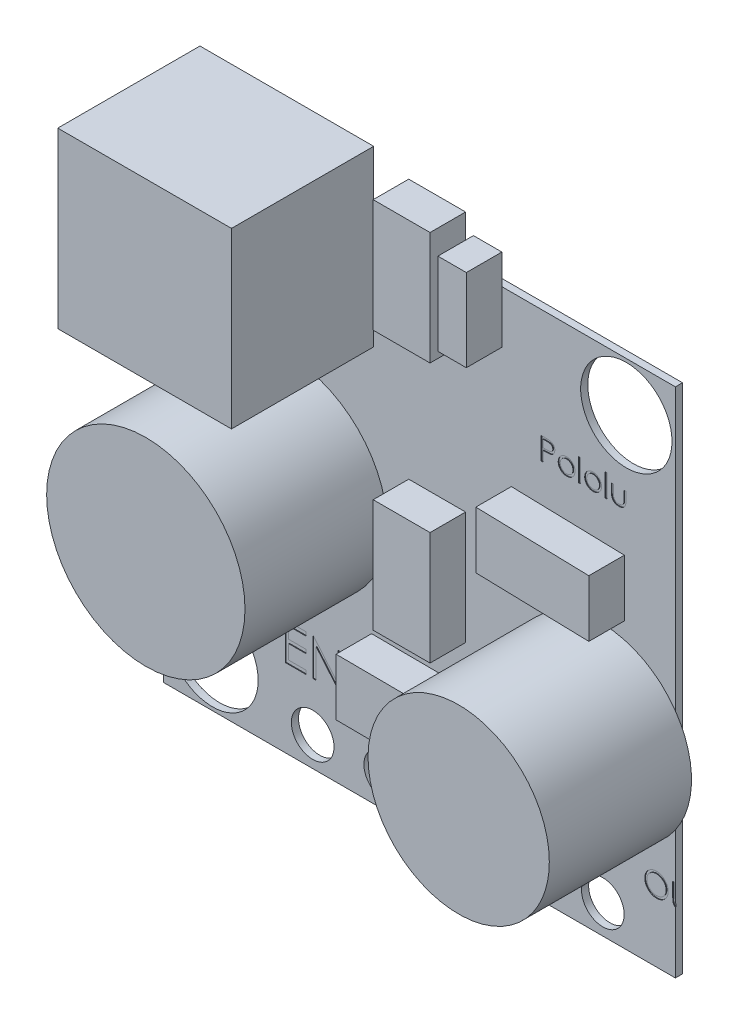
from build123d import *

# Parameters (mm, degrees)
SKETCH1_W           = 18.291840078
SKETCH1_H           = 18.291840078
SKETCH1_R           = 1.63195
SKETCH1_R_2         = 0.762
BOSS_EXTRUDE2_DEPTH = 0.254
SKETCH2_R           = 3.5433
SKETCH2_R_2         = 3.2385
SKETCH2_W           = 6.206288666
SKETCH2_H           = 6.206288667
BOSS_EXTRUDE3_DEPTH = 5.08
SKETCH3_W           = 2.032
SKETCH3_H           = 4.0386
SKETCH3_W_2         = 1.016
SKETCH3_H_2         = 2.9464
BOSS_EXTRUDE4_DEPTH = 1.27
SKETCH4_W           = 0.071233975
SKETCH4_H           = 0.814102564
SKETCH4_W_2         = 0.071233974
SKETCH4_H_2         = 0.79375
CUT_EXTRUDE1_DEPTH  = 0.0254


with BuildPart() as part:
    # Sketch1 → Boss-Extrude2 (new body)
    with BuildSketch(Plane.XY):
        with Locations((8.062281232, 8.564786777)):
            Rectangle(SKETCH1_W, SKETCH1_H)
        with Locations((0.668961193, 1.171466738)):
            Circle(SKETCH1_R, mode=Mode.SUBTRACT)
        with Locations((15.455601271, 15.958106816)):
            Circle(SKETCH1_R, mode=Mode.SUBTRACT)
        with Locations((4.250361193, 0.465539417)):
            Circle(SKETCH1_R_2, mode=Mode.SUBTRACT)
        with Locations((6.841929209, 0.465539417)):
            Circle(SKETCH1_R_2, mode=Mode.SUBTRACT)
        with Locations((9.433497224, 0.465539417)):
            Circle(SKETCH1_R_2, mode=Mode.SUBTRACT)
        with Locations((12.02506524, 0.465539417)):
            Circle(SKETCH1_R_2, mode=Mode.SUBTRACT)
        with Locations((14.616633255, 0.465539417)):
            Circle(SKETCH1_R_2, mode=Mode.SUBTRACT)
    extrude(amount=BOSS_EXTRUDE2_DEPTH)

    # Sketch2 → Boss-Extrude3 (add)
    with BuildSketch(Plane.XY.offset(0.254)):
        with Locations(Location((3.367424674, 8.222212501, 0), (0, 0, 180))):
            Circle(SKETCH2_R)
        with Locations(Location((14.545239743, 5.842060174, 0), (0, 0, 325.313926987))):
            Circle(SKETCH2_R_2)
        with Locations((3.324815917, 16.660413121)):
            Rectangle(SKETCH2_W, SKETCH2_H)
    extrude(amount=BOSS_EXTRUDE3_DEPTH)

    # Sketch3 → Boss-Extrude4 (add)
    with BuildSketch(Plane.XY.offset(0.254)):
        Polygon((6.3543759, 4.646336431), (10.392892165, 4.620330016), (10.393031369, 2.588330021), (6.354515103, 2.614336436), align=None)
        with Locations((8.696702908, 8.069982675)):
            Rectangle(SKETCH3_W, SKETCH3_H)
        with Locations((8.696702908, 17.354271733)):
            Rectangle(SKETCH3_W, SKETCH3_H)
        Polygon((11.34760699, 11.694074063), (15.38486701, 11.590047681), (15.387094643, 9.558048902), (11.349834623, 9.662075284), align=None)
        with Locations((10.50132769, 17.309698928)):
            Rectangle(SKETCH3_W_2, SKETCH3_H_2)
    extrude(amount=BOSS_EXTRUDE4_DEPTH)

    # Sketch4 → Cut-Extrude1 (cut)
    # profile 1 of 17: a face of its own
    with BuildSketch(Plane.XY.offset(0.254)):
        with BuildLine():
            Line((12.411607051, 13.80859367), (12.567272366, 13.80859367))
            add(Edge.make_bspline(
                [(12.567272366, 13.80859367), (12.577979125, 13.8085819), (12.598493751, 13.80855935), (12.627911272, 13.807875649), (12.654628837, 13.806962452), (12.678588834, 13.805696559), (12.699864985, 13.804200546), (12.718361015, 13.802102316), (12.734222307, 13.799911499), (12.743726091, 13.797684144), (12.748060377, 13.796668339)],
                knots=[0, 0, 0, 0, 1.415646017, 2.712440637, 3.8905458, 4.950247383, 5.884950622, 6.709939814, 7.411656543, 8, 8, 8, 8], degree=3))
            add(Edge.make_bspline(
                [(12.748060377, 13.796668339), (12.753547125, 13.795166576), (12.764391332, 13.792198436), (12.780017104, 13.786253538), (12.79488378, 13.779204547), (12.809042365, 13.771170903), (12.822318874, 13.761807927), (12.834911386, 13.75149516), (12.846708775, 13.739994501), (12.857644698, 13.72743494), (12.867687857, 13.714027321), (12.876335124, 13.699571494), (12.883575763, 13.684310788), (12.889785898, 13.668255817), (12.894255494, 13.651271761), (12.897622559, 13.633476632), (12.899759703, 13.614872336), (12.899964391, 13.602158759), (12.90006859, 13.595686769)],
                knots=[0, 0, 0, 0, 0.999701418, 1.975846123, 2.934577507, 3.890451536, 4.834027766, 5.787354733, 6.749476667, 7.726910423, 8.712836071, 9.690891519, 10.682875813, 11.679750201, 12.712814741, 13.765529915, 14.8625177, 16, 16, 16, 16], degree=3))
            add(Edge.make_bspline(
                [(12.90006859, 13.595686769), (12.899973017, 13.58916038), (12.899786022, 13.57639106), (12.897541685, 13.557710088), (12.894518588, 13.539857882), (12.88987015, 13.522874024), (12.883781935, 13.506859376), (12.876639987, 13.491569204), (12.868025865, 13.477263636), (12.858127841, 13.463890736), (12.847117033, 13.451437952), (12.835040027, 13.439995526), (12.821945581, 13.429630435), (12.807875308, 13.420319442), (12.792692038, 13.412278465), (12.77662605, 13.405076362), (12.759537697, 13.399027746), (12.74771252, 13.395845928), (12.7417002, 13.394228185)],
                knots=[0, 0, 0, 0, 1.121902311, 2.195077645, 3.232258892, 4.234102512, 5.217864754, 6.176164875, 7.132989551, 8.084763148, 9.034132444, 9.988522005, 10.94243251, 11.903244335, 12.886203696, 13.894208494, 14.929344452, 16, 16, 16, 16], degree=3))
            add(Edge.make_bspline(
                [(12.7417002, 13.394228185), (12.736727394, 13.393170687), (12.725829201, 13.39085312), (12.707880762, 13.388265845), (12.686983505, 13.386057496), (12.663165952, 13.384401703), (12.636449482, 13.382984208), (12.606819644, 13.381857516), (12.574218273, 13.381238424), (12.551478187, 13.381206494), (12.539605599, 13.381189824)],
                knots=[0, 0, 0, 0, 0.601384939, 1.31797006, 2.144135048, 3.087295005, 4.142315834, 5.309527816, 6.595305764, 8, 8, 8, 8], degree=3))
            Line((12.539605599, 13.381189824), (12.482841026, 13.381189824))
            Line((12.482841026, 13.381189824), (12.482841026, 13.01484367))
            Line((12.482841026, 13.01484367), (12.411607051, 13.01484367))
            Line((12.411607051, 13.01484367), (12.411607051, 13.80859367))
        make_face()
        with BuildLine():
            Line((12.482841026, 13.727183413), (12.482841026, 13.46260008))
            Line((12.482841026, 13.46260008), (12.621810878, 13.460851032))
            add(Edge.make_bspline(
                [(12.621810878, 13.460851032), (12.628596289, 13.460847525), (12.641695387, 13.460840755), (12.66061753, 13.461744546), (12.678172851, 13.462787881), (12.694307424, 13.464315493), (12.709028524, 13.466474778), (12.722360695, 13.468654583), (12.734200561, 13.47180812), (12.748056987, 13.476054245), (12.763497318, 13.483296106), (12.78029478, 13.493807599), (12.794530252, 13.507206259), (12.806848866, 13.522271143), (12.816624663, 13.539030409), (12.823781111, 13.556962115), (12.827985981, 13.575882359), (12.828549814, 13.588829134), (12.828834616, 13.59536876)],
                knots=[0, 0, 0, 0, 1.160613943, 2.240541288, 3.23993089, 4.169200891, 5.011653406, 5.7853311, 6.478053781, 7.106038997, 8.262395093, 9.384106736, 10.481365981, 11.59014053, 12.70357646, 13.786202915, 14.881775077, 16, 16, 16, 16], degree=3))
            add(Edge.make_bspline(
                [(12.828834616, 13.59536876), (12.828548265, 13.601750173), (12.827979037, 13.614435632), (12.823748153, 13.633027244), (12.816638577, 13.650769984), (12.806783242, 13.667319237), (12.794822307, 13.682329912), (12.780920492, 13.695369439), (12.76511052, 13.705851861), (12.750403868, 13.712617623), (12.737340742, 13.716748587), (12.725994208, 13.719638935), (12.71318293, 13.721946617), (12.698902737, 13.723815219), (12.683264312, 13.725414843), (12.666133302, 13.726500234), (12.6475746, 13.727135565), (12.634690774, 13.727167078), (12.628012049, 13.727183413)],
                knots=[0, 0, 0, 0, 1.120700087, 2.227813068, 3.331159281, 4.466773991, 5.599788987, 6.693661531, 7.80175334, 8.91857717, 9.525282508, 10.207424825, 10.974604443, 11.810962634, 12.737642355, 13.736264703, 14.826523623, 16, 16, 16, 16], degree=3))
            Line((12.628012049, 13.727183413), (12.482841026, 13.727183413))
        make_face(mode=Mode.SUBTRACT)
    # profile 2 of 17: a face of its own
    with BuildSketch(Plane.XY.offset(0.254)):
        with BuildLine():
            add(Edge.make_bspline(
                [(13.322702304, 13.605068029), (13.333586039, 13.604836278), (13.354926384, 13.604381873), (13.386179243, 13.599525264), (13.416011801, 13.59209863), (13.444538313, 13.581831686), (13.471393437, 13.568069887), (13.496968344, 13.551648494), (13.521192915, 13.532194227), (13.535712424, 13.517145165), (13.543082412, 13.50950638)],
                knots=[0, 0, 0, 0, 1.054011418, 2.066658804, 3.057071809, 4.030435133, 4.997543892, 5.974964718, 6.972108034, 8, 8, 8, 8], degree=3))
            add(Edge.make_bspline(
                [(13.543082412, 13.50950638), (13.549428319, 13.502200708), (13.561997324, 13.48773075), (13.578114013, 13.464268495), (13.591998189, 13.43997065), (13.603124967, 13.41451456), (13.611898178, 13.388122447), (13.618127006, 13.360703598), (13.621831989, 13.332318566), (13.62233159, 13.31304091), (13.622584616, 13.303277664)],
                knots=[0, 0, 0, 0, 1.025258237, 2.030674902, 3.01204498, 3.988269485, 4.97094183, 5.956517959, 6.965070386, 8, 8, 8, 8], degree=3))
            add(Edge.make_bspline(
                [(13.622584616, 13.303277664), (13.622362062, 13.29345783), (13.621922287, 13.274053379), (13.617762216, 13.245473987), (13.611291774, 13.217761947), (13.602031696, 13.191033279), (13.590157625, 13.16520628), (13.57566813, 13.140393757), (13.558461531, 13.116546756), (13.538957053, 13.093867767), (13.517400645, 13.072965787), (13.494015376, 13.054748483), (13.469260801, 13.039140744), (13.442807754, 13.026568557), (13.414897806, 13.016655821), (13.385470757, 13.009693496), (13.354572321, 13.005483971), (13.333475077, 13.004943411), (13.322702304, 13.004667388)],
                knots=[0, 0, 0, 0, 0.998656419, 1.973391657, 2.932242238, 3.890759089, 4.846373663, 5.82037756, 6.809684879, 7.83454468, 8.860553229, 9.859544525, 10.845671541, 11.83227036, 12.833544569, 13.85385346, 14.904124723, 16, 16, 16, 16], degree=3))
            add(Edge.make_bspline(
                [(13.322702304, 13.004667388), (13.311876751, 13.004944338), (13.29067436, 13.005486758), (13.259666861, 13.009677142), (13.230187072, 13.016652613), (13.202240586, 13.026601133), (13.175673808, 13.039141146), (13.150775799, 13.054701297), (13.127371533, 13.072971189), (13.105810565, 13.093866304), (13.08630731, 13.116547133), (13.069100395, 13.14039366), (13.054610982, 13.165206306), (13.042736889, 13.191033272), (13.033476818, 13.217761948), (13.027006373, 13.245473986), (13.022846304, 13.274053379), (13.022406528, 13.29345783), (13.022183975, 13.303277664)],
                knots=[0, 0, 0, 0, 1.099876186, 2.154163076, 3.173186993, 4.173200201, 5.163417411, 6.152872554, 7.150605724, 8.17532212, 9.198891216, 10.186952605, 11.159729845, 12.11414092, 13.071450619, 14.029093627, 15.002601286, 16, 16, 16, 16], degree=3))
            add(Edge.make_bspline(
                [(13.022183975, 13.303277664), (13.022438725, 13.312987845), (13.022943088, 13.332212335), (13.026644346, 13.360544007), (13.032848876, 13.387916451), (13.041632603, 13.414206693), (13.052861941, 13.439551229), (13.066551019, 13.46390911), (13.082832109, 13.487265272), (13.095351123, 13.50171653), (13.101686178, 13.509029367)],
                knots=[0, 0, 0, 0, 1.031353054, 2.041901799, 3.029428768, 4.008703097, 4.981709435, 5.96992636, 6.972712378, 8, 8, 8, 8], degree=3))
            add(Edge.make_bspline(
                [(13.101686178, 13.509029367), (13.109045055, 13.516734398), (13.123517581, 13.531887697), (13.147862739, 13.551285251), (13.173374731, 13.568048361), (13.200526634, 13.581536717), (13.22902971, 13.592159024), (13.259015146, 13.599544417), (13.290374057, 13.604364374), (13.311818828, 13.60483114), (13.322702304, 13.605068029)],
                knots=[0, 0, 0, 0, 1.027980169, 2.021703884, 2.998553061, 3.971491411, 4.943284454, 5.930300938, 6.949603206, 8, 8, 8, 8], degree=3))
        make_face()
        with BuildLine():
            add(Edge.make_bspline(
                [(13.322384295, 13.533834054), (13.31468773, 13.533615299), (13.299493284, 13.533183435), (13.277127771, 13.529898692), (13.255596701, 13.524694526), (13.234859224, 13.517300392), (13.214985272, 13.507752963), (13.195955818, 13.496026245), (13.17771489, 13.482275557), (13.160619315, 13.466522416), (13.144929755, 13.449314144), (13.131214214, 13.430978891), (13.119551734, 13.411814059), (13.109836198, 13.391799718), (13.102600104, 13.370733045), (13.097344793, 13.348852617), (13.094063149, 13.326113852), (13.093635346, 13.310655907), (13.093417949, 13.302800651)],
                knots=[0, 0, 0, 0, 1.021534396, 2.016698045, 2.994645724, 3.958388632, 4.93408049, 5.916473867, 6.921342795, 7.962252576, 8.998418191, 10.008913653, 10.997312074, 11.973003931, 12.956656626, 13.948281152, 14.957379055, 16, 16, 16, 16], degree=3))
            add(Edge.make_bspline(
                [(13.093417949, 13.302800651), (13.093782354, 13.29265153), (13.094505629, 13.272507424), (13.10038737, 13.24284133), (13.110226758, 13.21436116), (13.123513516, 13.187233873), (13.140160998, 13.162134981), (13.159775029, 13.139757698), (13.182145104, 13.120438773), (13.20700456, 13.104409367), (13.233845629, 13.091673137), (13.262251973, 13.082647297), (13.291879416, 13.076779967), (13.312127011, 13.076196794), (13.322384295, 13.075901362)],
                knots=[0, 0, 0, 0, 1.016792936, 2.018143844, 3.017858371, 4.030088057, 5.03801393, 6.028138512, 7.003788237, 7.991172063, 8.984598303, 9.972568034, 10.972917682, 12, 12, 12, 12], degree=3))
            add(Edge.make_bspline(
                [(13.322384295, 13.075901362), (13.332640989, 13.076198515), (13.352887419, 13.076785086), (13.382473697, 13.082617747), (13.410802401, 13.091712685), (13.437615591, 13.104395043), (13.462463731, 13.120499644), (13.484994693, 13.139648608), (13.504441253, 13.16219425), (13.521072267, 13.187267118), (13.534576617, 13.214319105), (13.544369951, 13.242846587), (13.550265832, 13.272506086), (13.550987198, 13.292651082), (13.551350641, 13.302800651)],
                knots=[0, 0, 0, 0, 1.02726834, 2.027799167, 3.010890988, 4.004497153, 4.992059811, 5.971914811, 6.958719428, 7.966827853, 8.981595046, 9.981490638, 10.983022906, 12, 12, 12, 12], degree=3))
            add(Edge.make_bspline(
                [(13.551350641, 13.302800651), (13.551133319, 13.310655954), (13.550705663, 13.326113992), (13.547422948, 13.348852084), (13.542171602, 13.370735), (13.534920896, 13.391792507), (13.525247575, 13.411865879), (13.513360195, 13.430922621), (13.499700659, 13.449377659), (13.483821776, 13.466466788), (13.466744046, 13.482281698), (13.448495725, 13.496031578), (13.429494489, 13.507701425), (13.409678274, 13.517382055), (13.388938138, 13.524627255), (13.367437236, 13.529928741), (13.345167149, 13.533169554), (13.330027151, 13.533611137), (13.322384295, 13.533834054)],
                knots=[0, 0, 0, 0, 1.042956736, 2.052379634, 3.044323526, 4.02829302, 5.004299113, 5.996692471, 7.007513377, 8.048758398, 9.090003419, 10.095195979, 11.07790575, 12.047570684, 13.018257071, 13.989683339, 14.985167495, 16, 16, 16, 16], degree=3))
        make_face(mode=Mode.SUBTRACT)
    # profile 3 of 17: a face of its own
    with BuildSketch(Plane.XY.offset(0.254)):
        with Locations((13.79049327, 13.421894952)):
            Rectangle(SKETCH4_W, SKETCH4_H)
    # profile 4 of 17: a face of its own
    with BuildSketch(Plane.XY.offset(0.254)):
        with BuildLine():
            add(Edge.make_bspline(
                [(14.269096535, 13.605068029), (14.27998027, 13.604836278), (14.301320614, 13.604381873), (14.332573474, 13.599525264), (14.362406032, 13.59209863), (14.390932543, 13.581831686), (14.417787667, 13.568069887), (14.443362575, 13.551648494), (14.467587146, 13.532194227), (14.482106655, 13.517145165), (14.489476643, 13.50950638)],
                knots=[0, 0, 0, 0, 1.054011418, 2.066658804, 3.057071809, 4.030435133, 4.997543892, 5.974964718, 6.972108034, 8, 8, 8, 8], degree=3))
            add(Edge.make_bspline(
                [(14.489476643, 13.50950638), (14.49582255, 13.502200708), (14.508391554, 13.48773075), (14.524508244, 13.464268495), (14.538392419, 13.43997065), (14.549519198, 13.41451456), (14.558292409, 13.388122447), (14.564521236, 13.360703598), (14.56822622, 13.332318566), (14.568725821, 13.31304091), (14.568978846, 13.303277664)],
                knots=[0, 0, 0, 0, 1.025258237, 2.030674902, 3.01204498, 3.988269485, 4.97094183, 5.956517959, 6.965070386, 8, 8, 8, 8], degree=3))
            add(Edge.make_bspline(
                [(14.568978846, 13.303277664), (14.568756293, 13.29345783), (14.568316517, 13.274053379), (14.564156447, 13.245473987), (14.557686005, 13.217761947), (14.548425927, 13.191033279), (14.536551856, 13.16520628), (14.522062361, 13.140393757), (14.504855762, 13.116546756), (14.485351284, 13.093867767), (14.463794876, 13.072965787), (14.440409607, 13.054748483), (14.415655031, 13.039140744), (14.389201985, 13.026568557), (14.361292037, 13.016655821), (14.331864988, 13.009693496), (14.300966552, 13.005483971), (14.279869307, 13.004943411), (14.269096535, 13.004667388)],
                knots=[0, 0, 0, 0, 0.998656419, 1.973391657, 2.932242238, 3.890759089, 4.846373663, 5.82037756, 6.809684879, 7.83454468, 8.860553229, 9.859544525, 10.845671541, 11.83227036, 12.833544569, 13.85385346, 14.904124723, 16, 16, 16, 16], degree=3))
            add(Edge.make_bspline(
                [(14.269096535, 13.004667388), (14.258270982, 13.004944338), (14.237068591, 13.005486758), (14.206061091, 13.009677142), (14.176581303, 13.016652613), (14.148634817, 13.026601133), (14.122068039, 13.039141146), (14.09717003, 13.054701297), (14.073765764, 13.072971189), (14.052204796, 13.093866304), (14.03270154, 13.116547133), (14.015494626, 13.14039366), (14.001005213, 13.165206306), (13.98913112, 13.191033272), (13.979871048, 13.217761948), (13.973400604, 13.245473986), (13.969240534, 13.274053379), (13.968800759, 13.29345783), (13.968578205, 13.303277664)],
                knots=[0, 0, 0, 0, 1.099876186, 2.154163076, 3.173186993, 4.173200201, 5.163417411, 6.152872554, 7.150605724, 8.17532212, 9.198891216, 10.186952605, 11.159729845, 12.11414092, 13.071450619, 14.029093627, 15.002601286, 16, 16, 16, 16], degree=3))
            add(Edge.make_bspline(
                [(13.968578205, 13.303277664), (13.968832956, 13.312987845), (13.969337319, 13.332212335), (13.973038577, 13.360544007), (13.979243107, 13.387916451), (13.988026834, 13.414206693), (13.999256172, 13.439551229), (14.01294525, 13.46390911), (14.02922634, 13.487265272), (14.041745354, 13.50171653), (14.048080409, 13.509029367)],
                knots=[0, 0, 0, 0, 1.031353054, 2.041901799, 3.029428768, 4.008703097, 4.981709435, 5.96992636, 6.972712378, 8, 8, 8, 8], degree=3))
            add(Edge.make_bspline(
                [(14.048080409, 13.509029367), (14.055439286, 13.516734398), (14.069911812, 13.531887697), (14.09425697, 13.551285251), (14.119768961, 13.568048361), (14.146920864, 13.581536717), (14.175423941, 13.592159024), (14.205409376, 13.599544417), (14.236768288, 13.604364374), (14.258213059, 13.60483114), (14.269096535, 13.605068029)],
                knots=[0, 0, 0, 0, 1.027980169, 2.021703884, 2.998553061, 3.971491411, 4.943284454, 5.930300938, 6.949603206, 8, 8, 8, 8], degree=3))
        make_face()
        with BuildLine():
            add(Edge.make_bspline(
                [(14.268778526, 13.533834054), (14.26108196, 13.533615299), (14.245887515, 13.533183435), (14.223522002, 13.529898692), (14.201990932, 13.524694526), (14.181253454, 13.517300392), (14.161379503, 13.507752963), (14.142350049, 13.496026245), (14.124109121, 13.482275557), (14.107013546, 13.466522416), (14.091323986, 13.449314144), (14.077608444, 13.430978891), (14.065945965, 13.411814059), (14.056230429, 13.391799718), (14.048994334, 13.370733045), (14.043739024, 13.348852617), (14.04045738, 13.326113852), (14.040029576, 13.310655907), (14.03981218, 13.302800651)],
                knots=[0, 0, 0, 0, 1.021534396, 2.016698045, 2.994645724, 3.958388632, 4.93408049, 5.916473867, 6.921342795, 7.962252576, 8.998418191, 10.008913653, 10.997312074, 11.973003931, 12.956656626, 13.948281152, 14.957379055, 16, 16, 16, 16], degree=3))
            add(Edge.make_bspline(
                [(14.03981218, 13.302800651), (14.040176584, 13.29265153), (14.040899859, 13.272507424), (14.046781601, 13.24284133), (14.056620989, 13.21436116), (14.069907747, 13.187233873), (14.086555229, 13.162134981), (14.10616926, 13.139757698), (14.128539335, 13.120438773), (14.153398791, 13.104409367), (14.18023986, 13.091673137), (14.208646204, 13.082647297), (14.238273647, 13.076779967), (14.258521241, 13.076196794), (14.268778526, 13.075901362)],
                knots=[0, 0, 0, 0, 1.016792936, 2.018143844, 3.017858371, 4.030088057, 5.03801393, 6.028138512, 7.003788237, 7.991172063, 8.984598303, 9.972568034, 10.972917682, 12, 12, 12, 12], degree=3))
            add(Edge.make_bspline(
                [(14.268778526, 13.075901362), (14.27903522, 13.076198515), (14.29928165, 13.076785086), (14.328867928, 13.082617747), (14.357196632, 13.091712685), (14.384009822, 13.104395043), (14.408857962, 13.120499644), (14.431388923, 13.139648608), (14.450835483, 13.16219425), (14.467466497, 13.187267118), (14.480970848, 13.214319105), (14.490764181, 13.242846587), (14.496660062, 13.272506086), (14.497381429, 13.292651082), (14.497744872, 13.302800651)],
                knots=[0, 0, 0, 0, 1.02726834, 2.027799167, 3.010890988, 4.004497153, 4.992059811, 5.971914811, 6.958719428, 7.966827853, 8.981595046, 9.981490638, 10.983022906, 12, 12, 12, 12], degree=3))
            add(Edge.make_bspline(
                [(14.497744872, 13.302800651), (14.49752755, 13.310655954), (14.497099894, 13.326113992), (14.493817178, 13.348852084), (14.488565833, 13.370735), (14.481315127, 13.391792507), (14.471641806, 13.411865879), (14.459754426, 13.430922621), (14.44609489, 13.449377659), (14.430216007, 13.466466788), (14.413138277, 13.482281698), (14.394889956, 13.496031578), (14.375888719, 13.507701425), (14.356072505, 13.517382055), (14.335332369, 13.524627255), (14.313831467, 13.529928741), (14.291561379, 13.533169554), (14.276421382, 13.533611137), (14.268778526, 13.533834054)],
                knots=[0, 0, 0, 0, 1.042956736, 2.052379634, 3.044323526, 4.02829302, 5.004299113, 5.996692471, 7.007513377, 8.048758398, 9.090003419, 10.095195979, 11.07790575, 12.047570684, 13.018257071, 13.989683339, 14.985167495, 16, 16, 16, 16], degree=3))
        make_face(mode=Mode.SUBTRACT)
    # profile 5 of 17: a face of its own
    with BuildSketch(Plane.XY.offset(0.254)):
        with Locations((14.7368875, 13.421894952)):
            Rectangle(SKETCH4_W_2, SKETCH4_H)
    # profile 6 of 17: a face of its own
    with BuildSketch(Plane.XY.offset(0.254)):
        with BuildLine():
            Line((14.925148718, 13.594891747), (14.996382692, 13.594891747))
            Line((14.996382692, 13.594891747), (14.996382692, 13.32585629))
            add(Edge.make_bspline(
                [(14.996382692, 13.32585629), (14.996414874, 13.317958988), (14.996476437, 13.302851819), (14.996893936, 13.281113232), (14.99787594, 13.26128837), (14.999103718, 13.243365782), (15.000682631, 13.227348498), (15.002561179, 13.213292466), (15.004660856, 13.201038285), (15.00671615, 13.193657916), (15.007672005, 13.190225531)],
                knots=[0, 0, 0, 0, 1.388932606, 2.656963016, 3.823490214, 4.879454478, 5.816252168, 6.653371382, 7.373723809, 8, 8, 8, 8], degree=3))
            add(Edge.make_bspline(
                [(15.007672005, 13.190225531), (15.009205407, 13.185911415), (15.012240331, 13.177372874), (15.01774521, 13.165038225), (15.024555208, 13.15361383), (15.032007347, 13.142659157), (15.040602391, 13.132498706), (15.050231593, 13.123149636), (15.060572622, 13.114258709), (15.075938493, 13.1037393), (15.096952291, 13.092464574), (15.124541398, 13.082736415), (15.154455392, 13.076922577), (15.175130248, 13.076248059), (15.185756941, 13.075901362)],
                knots=[0, 0, 0, 0, 0.725840625, 1.436591201, 2.137033971, 2.831655856, 3.53531722, 4.242432219, 4.957935707, 5.694543706, 7.190802206, 8.724350549, 10.316345118, 12, 12, 12, 12], degree=3))
            add(Edge.make_bspline(
                [(15.185756941, 13.075901362), (15.196382647, 13.076255431), (15.216941423, 13.076940489), (15.246526746, 13.082561041), (15.273571264, 13.09195126), (15.297803533, 13.105061155), (15.319113643, 13.121104444), (15.336871967, 13.139929656), (15.351523969, 13.160941214), (15.357921463, 13.176617613), (15.361138802, 13.184501372)],
                knots=[0, 0, 0, 0, 1.157059328, 2.238695713, 3.266970494, 4.264342957, 5.228770407, 6.160125903, 7.074715775, 8, 8, 8, 8], degree=3))
            add(Edge.make_bspline(
                [(15.361138802, 13.184501372), (15.362089994, 13.187668729), (15.364192846, 13.194670982), (15.366452165, 13.206549961), (15.368487444, 13.220716041), (15.370225343, 13.23726192), (15.371464764, 13.25614436), (15.372132881, 13.277357459), (15.372887686, 13.300834625), (15.372899142, 13.317269278), (15.372905128, 13.32585629)],
                knots=[0, 0, 0, 0, 0.557542046, 1.232589297, 2.036731608, 2.971723315, 4.038036528, 5.22795436, 6.551621927, 8, 8, 8, 8], degree=3))
            Line((15.372905128, 13.32585629), (15.372905128, 13.594891747))
            Line((15.372905128, 13.594891747), (15.444139103, 13.594891747))
            Line((15.444139103, 13.594891747), (15.444139103, 13.31249992))
            add(Edge.make_bspline(
                [(15.444139103, 13.31249992), (15.444038933, 13.302905258), (15.443844589, 13.284290301), (15.442595602, 13.257238368), (15.440452565, 13.232028359), (15.437199849, 13.208646929), (15.433374955, 13.187111929), (15.428440943, 13.167395758), (15.42254945, 13.149559163), (15.415903378, 13.133289152), (15.408051633, 13.118537446), (15.399699791, 13.104536645), (15.39005578, 13.09163414), (15.37990253, 13.079187655), (15.368608226, 13.067816273), (15.356384508, 13.057259063), (15.343403425, 13.047354644), (15.329376911, 13.0384893), (15.314509732, 13.030502668), (15.298783536, 13.023423307), (15.282005703, 13.017821116), (15.264392699, 13.012988161), (15.245858233, 13.009197558), (15.226420173, 13.006524533), (15.206085065, 13.004885932), (15.192226313, 13.004741459), (15.185120924, 13.004667388)],
                knots=[0, 0, 0, 0, 1.493040784, 2.896703357, 4.213163133, 5.428574705, 6.569057535, 7.615249723, 8.588095153, 9.490268104, 10.346124644, 11.18633936, 12.024365274, 12.850166724, 13.684164916, 14.514361689, 15.362232829, 16.222528818, 17.093394965, 17.986930858, 18.902426812, 19.842810585, 20.827885679, 21.843828298, 22.894529745, 24, 24, 24, 24], degree=3))
            add(Edge.make_bspline(
                [(15.185120924, 13.004667388), (15.178068678, 13.004744428), (15.16421036, 13.004895821), (15.143874203, 13.006515481), (15.124382287, 13.009193405), (15.105803911, 13.013015928), (15.088120431, 13.017787288), (15.07126022, 13.023457733), (15.055420698, 13.030506342), (15.040411565, 13.038438752), (15.026350309, 13.047411592), (15.013172113, 13.057246843), (15.000894649, 13.067929826), (14.989515206, 13.079415923), (14.979193513, 13.091847621), (14.969800947, 13.105124917), (14.961192908, 13.119116255), (14.953402186, 13.134098437), (14.946709342, 13.150556732), (14.940800384, 13.168766966), (14.935967436, 13.188928787), (14.932034412, 13.211024957), (14.928870424, 13.234949725), (14.926673746, 13.260841491), (14.925445513, 13.288637185), (14.925249783, 13.307834571), (14.925148718, 13.317747065)],
                knots=[0, 0, 0, 0, 1.083640291, 2.129454052, 3.13281866, 4.105697902, 5.042300162, 5.946461698, 6.836384745, 7.703652036, 8.553297018, 9.397182691, 10.228592656, 11.052265423, 11.879314572, 12.708807002, 13.549817954, 14.402308542, 15.300838682, 16.27712199, 17.341985831, 18.484375296, 19.725102775, 21.0496083, 22.476576903, 24, 24, 24, 24], degree=3))
            Line((14.925148718, 13.317747065), (14.925148718, 13.594891747))
        make_face()
    # profile 7 of 17: a face of its own
    with BuildSketch(Plane.XY.offset(0.254)):
        Polygon((3.27317911, 3.533575266), (4.019439794, 3.533575266), (4.019439794, 3.397891506), (3.3919024, 3.397891506), (3.3919024, 2.990840224), (4.019439794, 2.990840224), (4.019439794, 2.855156463), (3.3919024, 2.855156463), (3.3919024, 2.34634236), (4.019439794, 2.34634236), (4.019439794, 2.2106586), (3.27317911, 2.2106586), align=None)
    # profile 8 of 17: a face of its own
    with BuildSketch(Plane.XY.offset(0.254)):
        Polygon((4.256886375, 2.2106586), (4.256886375, 3.533575266), (4.281797065, 3.533575266), (5.155791289, 2.492361408), (5.155791289, 3.533575266), (5.27451458, 3.533575266), (5.27451458, 2.2106586), (5.247483831, 2.2106586), (4.375609665, 3.249487392), (4.375609665, 2.2106586), align=None)
    # profile 9 of 17: a face of its own
    with BuildSketch(Plane.XY.offset(0.254)):
        Polygon((7.071247738, 2.412278047), (7.147569853, 2.412278047), (7.412153187, 1.78675471), (7.67673652, 2.412278047), (7.753058635, 2.412278047), (7.417241328, 1.618528047), (7.407065046, 1.618528047), align=None)
    # profile 10 of 17: a face of its own
    with BuildSketch(Plane.XY.offset(0.254)):
        with Locations((7.931143572, 2.015403047)):
            Rectangle(SKETCH4_W, SKETCH4_H_2)
    # profile 11 of 17: a face of its own
    with BuildSketch(Plane.XY.offset(0.254)):
        Polygon((8.1702862, 1.618528047), (8.1702862, 2.412278047), (8.185232614, 2.412278047), (8.709629148, 1.787549732), (8.709629148, 2.412278047), (8.780863123, 2.412278047), (8.780863123, 1.618528047), (8.764644673, 1.618528047), (8.241520174, 2.241825323), (8.241520174, 1.618528047), align=None)
    # profile 12 of 17: a face of its own
    with BuildSketch(Plane.XY.offset(0.254)):
        with BuildLine():
            Line((11.203994747, 2.287870893), (11.142937054, 2.229993289))
            add(Edge.make_bspline(
                [(11.142937054, 2.229993289), (11.131888307, 2.240387074), (11.110054275, 2.260926798), (11.074457934, 2.287576613), (11.037318681, 2.310406246), (10.998830311, 2.328981411), (10.959945961, 2.343802483), (10.921181756, 2.354354401), (10.88293532, 2.361083708), (10.857497397, 2.361888428), (10.844962796, 2.362284955)],
                knots=[0, 0, 0, 0, 1.08915593, 2.152340314, 3.188132944, 4.216796309, 5.218260357, 6.173443236, 7.099959455, 8, 8, 8, 8], degree=3))
            add(Edge.make_bspline(
                [(10.844962796, 2.362284955), (10.837271426, 2.362191155), (10.821908635, 2.362003799), (10.799089016, 2.359612521), (10.776508725, 2.356173347), (10.754210388, 2.351197243), (10.73215065, 2.344890545), (10.710406233, 2.337001699), (10.688936576, 2.327804349), (10.667943911, 2.317176609), (10.647592047, 2.305501716), (10.628370407, 2.292563922), (10.610156476, 2.278777892), (10.593292594, 2.263798474), (10.577681757, 2.247761353), (10.562952394, 2.230964853), (10.549622543, 2.21295008), (10.537582225, 2.194048483), (10.526841287, 2.17459204), (10.517359681, 2.154768023), (10.509400163, 2.134642184), (10.503102447, 2.11418927), (10.497906638, 2.093567511), (10.494251395, 2.072634119), (10.492190656, 2.05136668), (10.491834199, 2.037125159), (10.491655003, 2.029965745)],
                knots=[0, 0, 0, 0, 1.02818874, 2.053710826, 3.065248034, 4.081641283, 5.106893873, 6.131558223, 7.173050175, 8.228653731, 9.27666206, 10.308777013, 11.325269123, 12.329503258, 13.32196095, 14.316845687, 15.314881793, 16.315733098, 17.311955233, 18.285320748, 19.252783886, 20.203351036, 21.145449891, 22.095197417, 23.042428769, 24, 24, 24, 24], degree=3))
            add(Edge.make_bspline(
                [(10.491655003, 2.029965745), (10.491826389, 2.022647184), (10.492168693, 2.008030048), (10.494359516, 1.986214607), (10.498425385, 1.964723167), (10.503860919, 1.943485108), (10.510660139, 1.922464058), (10.519135726, 1.901751149), (10.529174532, 1.88134715), (10.54079425, 1.861435904), (10.553536478, 1.842040504), (10.56781107, 1.823770756), (10.582974095, 1.806383372), (10.599577962, 1.790264404), (10.617090251, 1.774982699), (10.636034178, 1.760959286), (10.656037236, 1.747924047), (10.677129943, 1.736041264), (10.699083431, 1.725425757), (10.721593444, 1.715986052), (10.744731895, 1.708211988), (10.768377184, 1.701876025), (10.792501122, 1.696682565), (10.817226163, 1.693341449), (10.84237051, 1.690916921), (10.859320164, 1.69073965), (10.86785943, 1.69065034)],
                knots=[0, 0, 0, 0, 0.93586088, 1.869166235, 2.799637598, 3.729985548, 4.670839027, 5.622275134, 6.589130586, 7.576015415, 8.568469353, 9.55398029, 10.53834874, 11.515998671, 12.510579167, 13.508179873, 14.527009472, 15.561807829, 16.601455013, 17.643573243, 18.680854198, 19.719860599, 20.772568776, 21.833555941, 22.908541556, 24, 24, 24, 24], degree=3))
            add(Edge.make_bspline(
                [(10.86785943, 1.69065034), (10.878150591, 1.690865463), (10.898358957, 1.691287894), (10.928064811, 1.694576352), (10.956595151, 1.699712321), (10.983869808, 1.707233873), (11.00992046, 1.716827742), (11.03484261, 1.728392767), (11.058440039, 1.742372532), (11.080783688, 1.758150892), (11.101366121, 1.775730148), (11.119929467, 1.794699516), (11.13617764, 1.814966916), (11.150352813, 1.836412979), (11.162079597, 1.859215218), (11.171705017, 1.883261888), (11.179083103, 1.908563806), (11.18211182, 1.926047087), (11.183642183, 1.934881109)],
                knots=[0, 0, 0, 0, 1.13008108, 2.219097802, 3.278683437, 4.311054135, 5.322181354, 6.324827112, 7.324222904, 8.330512327, 9.32562643, 10.293043162, 11.24128371, 12.174520618, 13.111833804, 14.052305215, 15.015860969, 16, 16, 16, 16], degree=3))
            Line((11.183642183, 1.934881109), (10.919058849, 1.934881109))
            Line((10.919058849, 1.934881109), (10.919058849, 2.016291366))
            Line((10.919058849, 2.016291366), (11.254876157, 2.016291366))
            add(Edge.make_bspline(
                [(11.254876157, 2.016291366), (11.254489295, 2.001117703), (11.253732136, 1.971420104), (11.248421061, 1.928110775), (11.239844816, 1.887205052), (11.228128995, 1.848659855), (11.212962637, 1.812529808), (11.19450851, 1.778778228), (11.172471261, 1.747623159), (11.147635857, 1.71881026), (11.119763903, 1.693108814), (11.089608519, 1.67051961), (11.057119885, 1.651491695), (11.022328732, 1.636011152), (10.985348956, 1.623929371), (10.946094984, 1.615363317), (10.904620049, 1.610231165), (10.876195481, 1.609575441), (10.861658258, 1.609240084)],
                knots=[0, 0, 0, 0, 1.140356446, 2.231883559, 3.274166699, 4.278491846, 5.25512956, 6.21435461, 7.1637429, 8.11826594, 9.068280886, 10.0076534, 10.945064095, 11.891975133, 12.864533718, 13.863980011, 14.907571808, 16, 16, 16, 16], degree=3))
            add(Edge.make_bspline(
                [(10.861658258, 1.609240084), (10.852697924, 1.609369152), (10.835025257, 1.609623717), (10.808924279, 1.611432865), (10.783542961, 1.614217925), (10.758885002, 1.618423694), (10.734859699, 1.623575053), (10.711587044, 1.630171505), (10.688978381, 1.637807085), (10.666998766, 1.646491997), (10.645847699, 1.656554855), (10.625430971, 1.667737576), (10.605635725, 1.679982499), (10.5865968, 1.693501388), (10.568214996, 1.708193124), (10.55060884, 1.724087156), (10.533679768, 1.741134892), (10.523075163, 1.753240489), (10.517731726, 1.759340244)],
                knots=[0, 0, 0, 0, 1.107784379, 2.184907829, 3.233506516, 4.263428166, 5.276301166, 6.270063455, 7.25232949, 8.225834625, 9.190232166, 10.146266622, 11.1027726, 12.066435141, 13.031522626, 14.010570082, 14.99756817, 16, 16, 16, 16], degree=3))
            add(Edge.make_bspline(
                [(10.517731726, 1.759340244), (10.509978845, 1.769017338), (10.494601773, 1.788210898), (10.474808334, 1.818963028), (10.457935158, 1.850804164), (10.444244599, 1.883822946), (10.433554354, 1.917988489), (10.425887579, 1.953257135), (10.421395569, 1.989674301), (10.420748427, 2.014318031), (10.420421029, 2.026785656)],
                knots=[0, 0, 0, 0, 1.023165419, 2.029347347, 3.013907458, 3.994755782, 4.975994455, 5.96558838, 6.970761222, 8, 8, 8, 8], degree=3))
            add(Edge.make_bspline(
                [(10.420421029, 2.026785656), (10.420541733, 2.036121574), (10.420781607, 2.054674757), (10.423690251, 2.082219539), (10.427863429, 2.109275232), (10.433997315, 2.135819718), (10.441729861, 2.161870728), (10.451380383, 2.187440355), (10.462616458, 2.21254369), (10.475676026, 2.237007943), (10.490209466, 2.260508479), (10.505982462, 2.282950695), (10.523218993, 2.303925894), (10.541637576, 2.323699714), (10.561457965, 2.342023738), (10.582494477, 2.359067617), (10.604763324, 2.374854213), (10.628334565, 2.389134872), (10.652856379, 2.401962693), (10.678269987, 2.413208817), (10.70456763, 2.422503248), (10.73155229, 2.430389444), (10.759428223, 2.436221271), (10.78799314, 2.44045054), (10.817395933, 2.443344462), (10.837270532, 2.443577202), (10.847347862, 2.443695212)],
                knots=[0, 0, 0, 0, 1.008945113, 2.00506715, 2.99143336, 3.967273523, 4.948097931, 5.927297278, 6.919902385, 7.919676788, 8.923139349, 9.905703106, 10.883022732, 11.856032218, 12.825136022, 13.798837087, 14.781400844, 15.773989409, 16.776158564, 17.77167057, 18.775803737, 19.789618931, 20.80898985, 21.851988756, 22.910860228, 24, 24, 24, 24], degree=3))
            add(Edge.make_bspline(
                [(10.847347862, 2.443695212), (10.855566178, 2.443563791), (10.871862132, 2.4433032), (10.896111361, 2.441496932), (10.919985777, 2.438634016), (10.94352078, 2.434727227), (10.966636223, 2.429405997), (10.989397958, 2.423038243), (11.01183898, 2.415624205), (11.033888958, 2.406782091), (11.055696154, 2.396746001), (11.077381822, 2.385449029), (11.098871865, 2.372698001), (11.120203552, 2.358455056), (11.141511398, 2.342964817), (11.162458379, 2.325784251), (11.183550119, 2.307590876), (11.197112316, 2.294509381), (11.203994747, 2.287870893)],
                knots=[0, 0, 0, 0, 0.985871117, 1.954866573, 2.915460327, 3.869826059, 4.81536089, 5.759505086, 6.70452669, 7.649098992, 8.607881297, 9.583363685, 10.581137262, 11.603961102, 12.659522466, 13.73993555, 14.853081303, 16, 16, 16, 16], degree=3))
        make_face()
    # profile 13 of 17: a face of its own
    with BuildSketch(Plane.XY.offset(0.254)):
        Polygon((11.41769667, 1.629592648), (11.41769667, 2.423342648), (11.432643084, 2.423342648), (11.957039619, 1.798614332), (11.957039619, 2.423342648), (12.028273593, 2.423342648), (12.028273593, 1.629592648), (12.012055143, 1.629592648), (11.488930644, 2.252889923), (11.488930644, 1.629592648), align=None)
    # profile 14 of 17: a face of its own
    with BuildSketch(Plane.XY.offset(0.254)):
        with BuildLine():
            Line((12.231799234, 1.629592648), (12.231799234, 2.423342648))
            Line((12.231799234, 2.423342648), (12.392075676, 2.423342648))
            add(Edge.make_bspline(
                [(12.392075676, 2.423342648), (12.406015965, 2.423242279), (12.432948529, 2.423048368), (12.471867781, 2.421818873), (12.50787767, 2.419643893), (12.540859765, 2.416475804), (12.570904611, 2.412585741), (12.597928081, 2.407709756), (12.622069906, 2.401952082), (12.63691744, 2.397043203), (12.643938657, 2.394721854)],
                knots=[0, 0, 0, 0, 1.314313732, 2.53924729, 3.670748893, 4.714932338, 5.66265055, 6.526160246, 7.303039223, 8, 8, 8, 8], degree=3))
            add(Edge.make_bspline(
                [(12.643938657, 2.394721854), (12.653122285, 2.391222391), (12.671281288, 2.38430282), (12.697136475, 2.371249873), (12.721476334, 2.356460473), (12.74443139, 2.339915126), (12.765477291, 2.321145354), (12.785436225, 2.300948479), (12.803491707, 2.278590052), (12.820026267, 2.25453376), (12.834934176, 2.229062991), (12.84789252, 2.202226279), (12.858654408, 2.174159912), (12.867588229, 2.144941941), (12.874629122, 2.114508119), (12.879432882, 2.082823011), (12.882601303, 2.050011837), (12.882919721, 2.027747271), (12.883081285, 2.01645037)],
                knots=[0, 0, 0, 0, 0.984719456, 1.947108742, 2.898477687, 3.838006223, 4.779231079, 5.722358779, 6.681677486, 7.655904652, 8.64651281, 9.637519902, 10.640069247, 11.656948941, 12.698408672, 13.768548281, 14.867775369, 16, 16, 16, 16], degree=3))
            add(Edge.make_bspline(
                [(12.883081285, 2.01645037), (12.882938644, 2.006639339), (12.882657556, 1.987305678), (12.880133586, 1.958812118), (12.876465028, 1.931163861), (12.870785361, 1.904492569), (12.863890505, 1.878564562), (12.855053993, 1.853656178), (12.8449313, 1.829538921), (12.833127131, 1.806538887), (12.820168281, 1.784748551), (12.806261386, 1.764207315), (12.791421278, 1.745208291), (12.775506447, 1.727693945), (12.758722554, 1.71169068), (12.740959715, 1.697064812), (12.722172094, 1.684102522), (12.702443841, 1.672294446), (12.681199433, 1.661993758), (12.658036478, 1.653278381), (12.632856193, 1.646056023), (12.605720385, 1.640030124), (12.576582168, 1.635250093), (12.545412974, 1.632046429), (12.512260692, 1.62987996), (12.489496108, 1.629690278), (12.477779052, 1.629592648)],
                knots=[0, 0, 0, 0, 1.105936401, 2.179363191, 3.223086493, 4.248585256, 5.251745608, 6.245858792, 7.225916811, 8.198733463, 9.158002045, 10.082870192, 10.993790845, 11.873723703, 12.748670949, 13.606408763, 14.465103618, 15.319838547, 16.196477973, 17.123216899, 18.106603292, 19.147568657, 20.255746949, 21.433717677, 22.679120308, 24, 24, 24, 24], degree=3))
            Line((12.477779052, 1.629592648), (12.231799234, 1.629592648))
        make_face()
        with BuildLine():
            Line((12.303033208, 1.711002904), (12.394142733, 1.711002904))
            add(Edge.make_bspline(
                [(12.394142733, 1.711002904), (12.407234703, 1.711059169), (12.432415356, 1.711167386), (12.468623509, 1.712116984), (12.501706872, 1.713668638), (12.531670143, 1.715840129), (12.558496404, 1.71871319), (12.582241718, 1.721916516), (12.60282825, 1.725907366), (12.615285462, 1.729524816), (12.621042022, 1.731196464)],
                knots=[0, 0, 0, 0, 1.375205317, 2.645023457, 3.804390687, 4.853969522, 5.800190428, 6.637939096, 7.370582563, 8, 8, 8, 8], degree=3))
            add(Edge.make_bspline(
                [(12.621042022, 1.731196464), (12.628287454, 1.733748156), (12.642605262, 1.738790595), (12.663215794, 1.747988493), (12.682437471, 1.758883748), (12.700605281, 1.770994621), (12.717461504, 1.784748268), (12.733205902, 1.799845617), (12.747806775, 1.816363503), (12.76111327, 1.834281426), (12.773021403, 1.853487862), (12.783333628, 1.87379399), (12.792371386, 1.89497732), (12.799464924, 1.917363147), (12.805024709, 1.940751344), (12.808962772, 1.965143557), (12.811415397, 1.99053523), (12.811701475, 2.007805444), (12.811847311, 2.016609374)],
                knots=[0, 0, 0, 0, 0.998632004, 1.973411704, 2.929992603, 3.868527914, 4.809262121, 5.754881198, 6.702106254, 7.672490631, 8.653608572, 9.636854334, 10.631411391, 11.644891563, 12.686317036, 13.754757253, 14.855430412, 16, 16, 16, 16], degree=3))
            add(Edge.make_bspline(
                [(12.811847311, 2.016609374), (12.811730905, 2.025892503), (12.811502223, 2.044129291), (12.808627871, 2.070887895), (12.804427447, 2.096623686), (12.798353289, 2.121338384), (12.790612894, 2.145080206), (12.780953037, 2.167717845), (12.769916143, 2.189490378), (12.756784494, 2.209895279), (12.742402743, 2.22919318), (12.726442045, 2.246872242), (12.709155976, 2.262972735), (12.690733073, 2.2777454), (12.670654123, 2.290595912), (12.649392126, 2.302090928), (12.626635161, 2.311846317), (12.610802639, 2.317034916), (12.602756516, 2.319671774)],
                knots=[0, 0, 0, 0, 1.122418816, 2.205001699, 3.251619955, 4.274784885, 5.280384055, 6.268708349, 7.249350384, 8.229342522, 9.199999885, 10.157847722, 11.105861043, 12.055065948, 13.010012805, 13.98527497, 14.976112212, 16, 16, 16, 16], degree=3))
            add(Edge.make_bspline(
                [(12.602756516, 2.319671774), (12.596100095, 2.321512464), (12.581946718, 2.325426276), (12.558850983, 2.329695601), (12.532857904, 2.333461265), (12.503852079, 2.336649427), (12.471866571, 2.338937087), (12.436876781, 2.340654153), (12.398867585, 2.341812265), (12.372519046, 2.341891347), (12.358843755, 2.341932391)],
                knots=[0, 0, 0, 0, 0.674548936, 1.434276114, 2.292660221, 3.240891867, 4.284742987, 5.42552168, 6.663806718, 8, 8, 8, 8], degree=3))
            Line((12.358843755, 2.341932391), (12.303033208, 2.341932391))
            Line((12.303033208, 2.341932391), (12.303033208, 1.711002904))
        make_face(mode=Mode.SUBTRACT)
    # profile 15 of 17: a face of its own
    with BuildSketch(Plane.XY.offset(0.254)):
        with BuildLine():
            add(Edge.make_bspline(
                [(16.527964664, 2.384876289), (16.542662216, 2.384504025), (16.571529422, 2.383772867), (16.613955337, 2.378175999), (16.654458153, 2.368493295), (16.693367809, 2.355597583), (16.730218895, 2.338394892), (16.765288787, 2.31760201), (16.798494042, 2.293001099), (16.829387105, 2.264782327), (16.857657521, 2.234079294), (16.882564463, 2.201313768), (16.90343834, 2.166683861), (16.920580117, 2.130293637), (16.934028195, 2.092225394), (16.943308049, 2.052276183), (16.949235808, 2.010704844), (16.949928815, 1.982350538), (16.950280369, 1.967966733)],
                knots=[0, 0, 0, 0, 1.065120563, 2.091984664, 3.0946048, 4.079830382, 5.057816894, 6.036188127, 7.030412546, 8.04752943, 9.064399622, 10.05169764, 11.02544977, 11.989514704, 12.962713494, 13.945757189, 14.957906945, 16, 16, 16, 16], degree=3))
            add(Edge.make_bspline(
                [(16.950280369, 1.967966733), (16.949928866, 1.953688884), (16.949236014, 1.925545589), (16.943301309, 1.884238058), (16.933993797, 1.844529989), (16.920705001, 1.806487671), (16.903644937, 1.770070974), (16.882632068, 1.735375718), (16.8578804, 1.70239053), (16.829712061, 1.671476765), (16.799005039, 1.643129124), (16.766068889, 1.618427879), (16.731644332, 1.597172587), (16.695288381, 1.580212718), (16.657483194, 1.5666573), (16.617890417, 1.557415186), (16.576695573, 1.55145366), (16.548603399, 1.550769104), (16.53432484, 1.550421161)],
                knots=[0, 0, 0, 0, 1.043624062, 2.057103931, 3.04512605, 4.022047818, 4.998200453, 5.980619268, 6.982898556, 8.009068085, 9.034988726, 10.034168286, 11.015286542, 11.987931943, 12.962482838, 13.94673481, 14.956375938, 16, 16, 16, 16], degree=3))
            add(Edge.make_bspline(
                [(16.53432484, 1.550421161), (16.519941111, 1.550772539), (16.491586951, 1.5514652), (16.449963373, 1.557402769), (16.409986099, 1.566687672), (16.371769452, 1.579956776), (16.335292119, 1.597105684), (16.300482761, 1.61801632), (16.267481098, 1.642828297), (16.236560737, 1.670987502), (16.208269401, 1.701642479), (16.183604329, 1.734488819), (16.16268899, 1.76888211), (16.145597663, 1.804917798), (16.132066616, 1.842421679), (16.122835345, 1.881643923), (16.116862727, 1.922360918), (16.116174467, 1.950083861), (16.115825241, 1.964150628)],
                knots=[0, 0, 0, 0, 1.053102029, 2.075944431, 3.073151272, 4.055350789, 5.033113405, 6.020478099, 7.024410459, 8.052272461, 9.079885166, 10.07527673, 11.055994387, 12.023226415, 12.992069828, 13.970394897, 14.97016774, 16, 16, 16, 16], degree=3))
            add(Edge.make_bspline(
                [(16.115825241, 1.964150628), (16.115946488, 1.973592322), (16.116187454, 1.9923566), (16.119088427, 2.02022099), (16.123297956, 2.047637264), (16.12933089, 2.074527461), (16.137221143, 2.100825756), (16.146531156, 2.126713518), (16.157902157, 2.151928399), (16.170756518, 2.176589846), (16.185103392, 2.200313425), (16.200950214, 2.222737902), (16.217740378, 2.244051449), (16.236147076, 2.263701752), (16.255563663, 2.282260456), (16.276305116, 2.299442358), (16.298244875, 2.315402392), (16.321477344, 2.329785219), (16.34543006, 2.342793451), (16.370121757, 2.353956264), (16.395217087, 2.363537067), (16.420833588, 2.371302397), (16.446903234, 2.377432877), (16.473482925, 2.381607402), (16.500551484, 2.384515774), (16.518787622, 2.3847556), (16.527964664, 2.384876289)],
                knots=[0, 0, 0, 0, 1.037015668, 2.060948919, 3.074880161, 4.083647147, 5.086022904, 6.090072063, 7.104153813, 8.122640571, 9.144368836, 10.147691507, 11.138137339, 12.123020368, 13.103399296, 14.087645067, 15.080126199, 16.082011238, 17.087798457, 18.072939717, 19.057185487, 20.037253025, 21.01195951, 21.997135196, 22.992090687, 24, 24, 24, 24], degree=3))
        make_face()
        with BuildLine():
            add(Edge.make_bspline(
                [(16.531462761, 2.303466032), (16.523930156, 2.303374209), (16.50893696, 2.30319144), (16.486647431, 2.300783948), (16.464651046, 2.297352705), (16.442943262, 2.292458324), (16.421614907, 2.285789905), (16.400467175, 2.278115271), (16.379692911, 2.268766916), (16.359360697, 2.258204892), (16.3396496, 2.246514333), (16.321050291, 2.23359395), (16.30351462, 2.219746743), (16.287085522, 2.204940394), (16.271811238, 2.189099502), (16.257391136, 2.172464217), (16.244403213, 2.154559056), (16.232500234, 2.135869553), (16.221848599, 2.116420052), (16.212376813, 2.096415315), (16.204628904, 2.075692161), (16.198310115, 2.054475415), (16.193071408, 2.032798678), (16.189752643, 2.010497513), (16.187318697, 1.987683978), (16.187146375, 1.972266665), (16.187059215, 1.964468636)],
                knots=[0, 0, 0, 0, 1.008559885, 2.007477868, 2.99961109, 3.989939068, 4.984837346, 5.991145699, 7.001802488, 8.033829008, 9.059044045, 10.069351652, 11.065060232, 12.050310815, 13.029377138, 14.011219647, 14.996725999, 15.989392538, 16.977580475, 17.965360261, 18.951710183, 19.937753436, 20.929683414, 21.935841486, 22.955955122, 24, 24, 24, 24], degree=3))
            add(Edge.make_bspline(
                [(16.187059215, 1.964468636), (16.187348336, 1.953001847), (16.187917125, 1.930443125), (16.192896788, 1.897384992), (16.200567129, 1.86561497), (16.211874067, 1.835306895), (16.226014296, 1.806200245), (16.243482894, 1.778553228), (16.264179151, 1.752358373), (16.287688558, 1.727798553), (16.313388529, 1.705381736), (16.340678273, 1.685705035), (16.369265431, 1.669056639), (16.39922455, 1.655493703), (16.430395688, 1.644746387), (16.462979704, 1.637380698), (16.496759541, 1.63253305), (16.519785243, 1.632067514), (16.531462761, 1.631831417)],
                knots=[0, 0, 0, 0, 1.032063989, 2.030389145, 3.003944642, 3.970395727, 4.937377036, 5.913328081, 6.909231446, 7.93887556, 8.970685674, 9.976071282, 10.964166581, 11.944589148, 12.933237628, 13.927779006, 14.949070134, 16, 16, 16, 16], degree=3))
            add(Edge.make_bspline(
                [(16.531462761, 1.631831417), (16.539311701, 1.631939255), (16.554878508, 1.632153129), (16.578032314, 1.634307293), (16.60076899, 1.637761663), (16.623056647, 1.642735223), (16.644869988, 1.648959857), (16.666300059, 1.656354824), (16.6871186, 1.66558074), (16.707588242, 1.675774293), (16.727181675, 1.687394829), (16.745885948, 1.699876695), (16.763229607, 1.713703507), (16.779646415, 1.728289868), (16.794983408, 1.743929884), (16.809136874, 1.76060322), (16.822059154, 1.778415119), (16.833957614, 1.797076273), (16.844571925, 1.816578995), (16.853820042, 1.836656261), (16.861665947, 1.857258634), (16.867999733, 1.87841583), (16.872963043, 1.900087665), (16.876382953, 1.922303158), (16.878775189, 1.945017866), (16.878955501, 1.960381205), (16.879046395, 1.968125738)],
                knots=[0, 0, 0, 0, 1.047197238, 2.076906641, 3.100256066, 4.114471768, 5.12198147, 6.126382909, 7.136867548, 8.15857795, 9.17633901, 10.174870724, 11.156907918, 12.133735059, 13.104061851, 14.077631395, 15.04955518, 16.038496417, 17.029181396, 18.010275684, 18.986308667, 19.968651475, 20.955262928, 21.950658345, 22.966943676, 24, 24, 24, 24], degree=3))
            add(Edge.make_bspline(
                [(16.879046395, 1.968125738), (16.878955428, 1.97581729), (16.878774979, 1.9910749), (16.876384096, 2.013631192), (16.87295943, 2.035686831), (16.868023959, 2.05715523), (16.861662584, 2.078041859), (16.853818672, 2.098327104), (16.844569149, 2.118086534), (16.833953712, 2.137271312), (16.822021195, 2.155680583), (16.808982322, 2.173279701), (16.794611966, 2.189738162), (16.779320707, 2.205462281), (16.762726595, 2.220116695), (16.7449048, 2.233706266), (16.72607168, 2.246558955), (16.70613104, 2.258153503), (16.685551607, 2.268861016), (16.664434692, 2.278034726), (16.643019521, 2.285829831), (16.621360553, 2.2924785), (16.599275484, 2.297333536), (16.576913544, 2.30078704), (16.554305672, 2.303190602), (16.539101227, 2.303373931), (16.531462761, 2.303466032)],
                knots=[0, 0, 0, 0, 1.02996197, 2.043119294, 3.035359645, 4.018872909, 4.991431989, 5.957985074, 6.929999688, 7.912076566, 8.892894881, 9.867085534, 10.843653904, 11.817741046, 12.803660682, 13.806313499, 14.818574707, 15.856120519, 16.894564902, 17.924820532, 18.937903209, 19.946497019, 20.957711757, 21.963978472, 22.977135795, 24, 24, 24, 24], degree=3))
        make_face(mode=Mode.SUBTRACT)
    # profile 16 of 17: a face of its own
    with BuildSketch(Plane.XY.offset(0.254)):
        with BuildLine():
            Line((17.113100882, 2.364523725), (17.184334856, 2.364523725))
            Line((17.184334856, 2.364523725), (17.184334856, 1.888941543))
            add(Edge.make_bspline(
                [(17.184334856, 1.888941543), (17.184324255, 1.882210376), (17.184304138, 1.869436827), (17.184438512, 1.851255802), (17.184814833, 1.835092226), (17.185052087, 1.820883796), (17.185579893, 1.808695708), (17.186010343, 1.798461933), (17.186563826, 1.790230926), (17.187229015, 1.785427394), (17.187514944, 1.783362617)],
                knots=[0, 0, 0, 0, 1.528628734, 2.90083645, 4.128790002, 5.200304208, 6.127813768, 6.898992206, 7.526736466, 8, 8, 8, 8], degree=3))
            add(Edge.make_bspline(
                [(17.187514944, 1.783362617), (17.188689118, 1.77591344), (17.190971305, 1.761434821), (17.196787537, 1.740818122), (17.204910434, 1.722237237), (17.21453591, 1.705112355), (17.227220627, 1.689920125), (17.242416072, 1.675924804), (17.26082603, 1.66368477), (17.281295846, 1.652492711), (17.303358748, 1.643497237), (17.325903803, 1.63669517), (17.348592122, 1.632549777), (17.363781359, 1.632069776), (17.371324039, 1.631831417)],
                knots=[0, 0, 0, 0, 1.035780045, 2.013197591, 2.933192213, 3.817615948, 4.702609284, 5.640816605, 6.646850145, 7.73207398, 8.84249596, 9.914020372, 10.964143139, 12, 12, 12, 12], degree=3))
            add(Edge.make_bspline(
                [(17.371324039, 1.631831417), (17.377799619, 1.632074951), (17.390713379, 1.632560612), (17.409900909, 1.635568115), (17.428588076, 1.640988422), (17.446867159, 1.647982439), (17.464001043, 1.65722341), (17.479999288, 1.667898404), (17.494278608, 1.680419442), (17.507309262, 1.694276127), (17.51865647, 1.709910689), (17.528492426, 1.726982695), (17.536549199, 1.745749065), (17.54052782, 1.758937657), (17.542571785, 1.765713128)],
                knots=[0, 0, 0, 0, 0.994687771, 1.983630487, 2.973142513, 3.978332533, 4.983357753, 5.956394766, 6.925816176, 7.893390482, 8.871859704, 9.88551698, 10.913711441, 12, 12, 12, 12], degree=3))
            add(Edge.make_bspline(
                [(17.542571785, 1.765713128), (17.543252171, 1.768513608), (17.544768344, 1.774754207), (17.546185084, 1.785304571), (17.547660672, 1.797752694), (17.548684511, 1.812188016), (17.549682645, 1.828562165), (17.550279789, 1.846960441), (17.550555794, 1.867316038), (17.550638045, 1.881521251), (17.55068101, 1.888941543)],
                knots=[0, 0, 0, 0, 0.558680831, 1.244966039, 2.062412453, 2.990489873, 4.051219941, 5.244515665, 6.560634259, 8, 8, 8, 8], degree=3))
            Line((17.55068101, 1.888941543), (17.55068101, 2.364523725))
            Line((17.55068101, 2.364523725), (17.621914984, 2.364523725))
            Line((17.621914984, 2.364523725), (17.621914984, 1.885125437))
            add(Edge.make_bspline(
                [(17.621914984, 1.885125437), (17.621857353, 1.876485269), (17.621744883, 1.859623456), (17.620769574, 1.834914844), (17.619214504, 1.811475864), (17.617017384, 1.789303366), (17.614106135, 1.768476691), (17.610868719, 1.748813288), (17.606745861, 1.730454306), (17.601930429, 1.713256597), (17.596425535, 1.696885954), (17.589295132, 1.681349178), (17.581261361, 1.666173948), (17.571733038, 1.651589788), (17.561026171, 1.637532123), (17.548904093, 1.624086208), (17.535767721, 1.611037174), (17.521398678, 1.598719747), (17.506033827, 1.587423851), (17.489718872, 1.577491142), (17.472579141, 1.569094714), (17.454659185, 1.56218321), (17.435951359, 1.556986506), (17.41645519, 1.553114105), (17.396126301, 1.550913762), (17.382300388, 1.550586753), (17.375299149, 1.550421161)],
                knots=[0, 0, 0, 0, 1.316592851, 2.569410997, 3.76748051, 4.895814652, 5.963796859, 6.97159953, 7.931736103, 8.829262218, 9.692595152, 10.560224239, 11.431080259, 12.30701507, 13.211635791, 14.121146779, 15.063487852, 16.031507147, 17.00238618, 17.966455255, 18.938106653, 19.907068911, 20.888905087, 21.893141452, 22.933117798, 24, 24, 24, 24], degree=3))
            add(Edge.make_bspline(
                [(17.375299149, 1.550421161), (17.367663477, 1.550599134), (17.352682317, 1.550948318), (17.330607434, 1.552949191), (17.309445108, 1.556718006), (17.288971828, 1.561516779), (17.26946633, 1.568135233), (17.250667281, 1.575868201), (17.232896651, 1.585365365), (17.215866149, 1.595932081), (17.200030892, 1.60782124), (17.185494516, 1.620779815), (17.172233024, 1.634600222), (17.160469945, 1.649432091), (17.150010387, 1.665160068), (17.141000142, 1.681828645), (17.133263746, 1.69943137), (17.129270828, 1.711667185), (17.127252274, 1.717852801)],
                knots=[0, 0, 0, 0, 1.13879206, 2.234305948, 3.301075583, 4.341971843, 5.366689343, 6.369221514, 7.369726634, 8.367512178, 9.355451585, 10.318319045, 11.268648973, 12.207971039, 13.137398894, 14.081662264, 15.030215811, 16, 16, 16, 16], degree=3))
            add(Edge.make_bspline(
                [(17.127252274, 1.717852801), (17.126078168, 1.722078403), (17.123531507, 1.731243827), (17.120804342, 1.746412727), (17.118511746, 1.76387861), (17.116356022, 1.783642672), (17.11508399, 1.805720231), (17.113968785, 1.830101717), (17.113093025, 1.856816612), (17.11309819, 1.875425404), (17.113100882, 1.885125437)],
                knots=[0, 0, 0, 0, 0.625038921, 1.35572334, 2.194682327, 3.136881307, 4.189498639, 5.346923369, 6.617055217, 8, 8, 8, 8], degree=3))
            Line((17.113100882, 1.885125437), (17.113100882, 2.364523725))
        make_face()
    # profile 17 of 17: a face of its own
    with BuildSketch(Plane.XY.offset(0.254)):
        Polygon((17.733854087, 2.283113468), (17.733854087, 2.364523725), (18.151081651, 2.364523725), (18.151081651, 2.283113468), (17.978084856, 2.283113468), (17.978084856, 1.570773725), (17.906850882, 1.570773725), (17.906850882, 2.283113468), align=None)
    extrude(amount=-CUT_EXTRUDE1_DEPTH, mode=Mode.SUBTRACT)


solid = part.part
